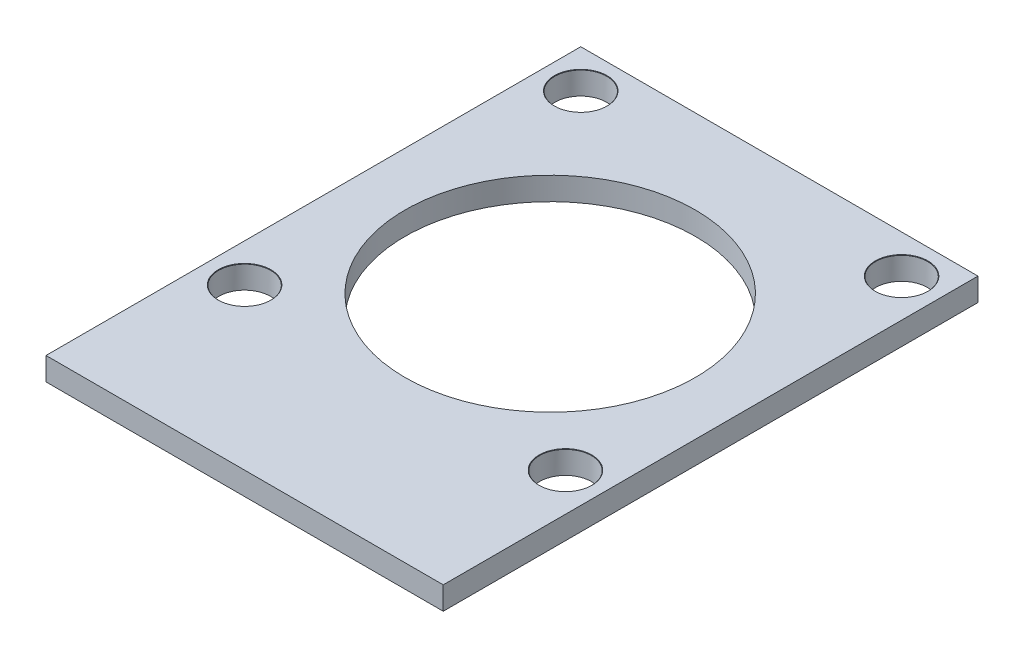
from build123d import *

# Parameters (mm, degrees)
SKETCH1_W                      = 26
SKETCH1_H                      = 35
BOSS_EXTRUDE1_DEPTH            = 1.5
M3_CLEARANCE_HOLE1_D           = 3.4
M3_CLEARANCE_HOLE1_DEPTH       = 3
M3_CLEARANCE_HOLE1_CSINK_D     = 3.45
M3_CLEARANCE_HOLE1_CSINK_ANGLE = 90
SKETCH4_R                      = 9.5
CUT_EXTRUDE1_DEPTH             = 44.626253564


with BuildPart() as part:
    # Sketch1 → Boss-Extrude1 (new body)
    with BuildSketch(Plane(origin=(0, 0, 0), x_dir=(1, 0, 0), z_dir=(0, 1, 0))):
        with Locations((13, 17.5)):
            Rectangle(SKETCH1_W, SKETCH1_H)
    extrude(amount=BOSS_EXTRUDE1_DEPTH)

    # M3 Clearance Hole1
    with Locations(Plane(origin=(0, 1.5, 0), x_dir=(1, 0, 0), z_dir=(0, 1, 0))):
        with Locations((2.5, 32.5), (2.5, 10.5), (23.5, 10.5), (23.5, 32.5)):
            CounterSinkHole(M3_CLEARANCE_HOLE1_D / 2, M3_CLEARANCE_HOLE1_CSINK_D / 2, depth=M3_CLEARANCE_HOLE1_DEPTH, counter_sink_angle=M3_CLEARANCE_HOLE1_CSINK_ANGLE)

    # Sketch4 → Cut-Extrude1 (cut, through all)
    with BuildSketch(Plane(origin=(0, 1.5, 0), x_dir=(1, 0, 0), z_dir=(0, 1, 0))):
        with Locations(Location((13, 20, 0), (0, 0, 270))):
            Circle(SKETCH4_R)
    extrude(amount=-CUT_EXTRUDE1_DEPTH, mode=Mode.SUBTRACT)


solid = part.part
